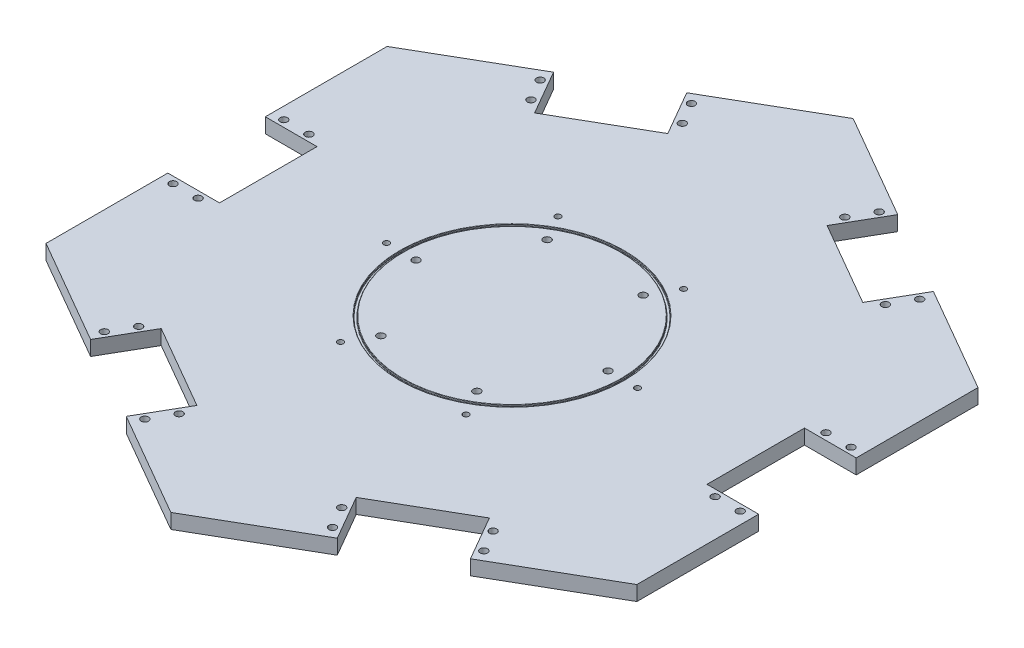
from build123d import *

# Parameters (mm, degrees)
BOSS_EXTRUDE1_DEPTH     = 10
CUT_EXTRUDE1_DEPTH      = 306.668665933
CUT_EXTRUDE1_DEPTH_BACK = 306.668665933
SKETCH2_R               = 2.5
SKETCH2_W               = 35
SKETCH2_H               = 66
FILLET1_R               = 0.254
CUT_EXTRUDE2_DEPTH      = 306.668665933
CUT_EXTRUDE2_DEPTH_BACK = 306.668665933
SKETCH5_R               = 2
SKETCH5_R_2             = 2.5


with BuildPart() as part:
    # Sketch1 → Boss-Extrude1 (new body)
    with BuildSketch(Plane(origin=(0, 0, 0), x_dir=(1, 0, 0), z_dir=(0, 1, 0))):
        Polygon((-200, 115.470053838), (0, 230.940107676), (200, 115.470053838), (200, -115.470053838), (0, -230.940107676), (-200, -115.470053838), align=None)
    extrude(amount=BOSS_EXTRUDE1_DEPTH)

    # Sketch2 → Cut-Extrude1 (cut, two sides: drawn at the far end of the back side and taken through both)
    with BuildSketch(Plane(origin=(0, 10, 0), x_dir=(1, 0, 0), z_dir=(0, 1, 0)).offset(-CUT_EXTRUDE1_DEPTH_BACK)):
        with Locations(Location((175, 37.5, 0), (0, 0, 270))):
            Circle(SKETCH2_R)
        with Locations((182.5, 0)):
            Rectangle(SKETCH2_W, SKETCH2_H)
        with Locations(Location((175, -37.5, 0), (0, 0, 270))):
            Circle(SKETCH2_R)
        Polygon((71.421161675, -189.705080757), (128.578838325, -156.705080757), (111.078838325, -126.394191624), (53.921161675, -159.394191624), align=None)
        Polygon((111.078838325, 126.394191624), (128.578838325, 156.705080757), (71.421161675, 189.705080757), (53.921161675, 159.394191624), align=None)
        Polygon((-128.578838325, -156.705080757), (-71.421161675, -189.705080757), (-53.921161675, -159.394191624), (-111.078838325, -126.394191624), align=None)
        Polygon((-53.921161675, 159.394191624), (-71.421161675, 189.705080757), (-128.578838325, 156.705080757), (-111.078838325, 126.394191624), align=None)
        with Locations((-182.5, 0)):
            Rectangle(SKETCH2_W, SKETCH2_H)
        with Locations(Location((192, 37.5, 0), (0, 0, 270))):
            Circle(SKETCH2_R)
        with Locations(Location((192, -37.5, 0), (0, 0, 270))):
            Circle(SKETCH2_R)
        with Locations(Location((119.975952642, -132.804445662, 0), (0, 0, 270))):
            Circle(SKETCH2_R)
        with Locations(Location((128.475952642, -147.526877527, 0), (0, 0, 270))):
            Circle(SKETCH2_R)
        with Locations(Location((55.024047358, -170.304445662, 0), (0, 0, 270))):
            Circle(SKETCH2_R)
        with Locations(Location((63.524047358, -185.026877527, 0), (0, 0, 270))):
            Circle(SKETCH2_R)
        with Locations(Location((-55.024047358, -170.304445662, 0), (0, 0, 270))):
            Circle(SKETCH2_R)
        with Locations(Location((-63.524047358, -185.026877527, 0), (0, 0, 270))):
            Circle(SKETCH2_R)
        with Locations(Location((-119.975952642, -132.804445662, 0), (0, 0, 270))):
            Circle(SKETCH2_R)
        with Locations(Location((-128.475952642, -147.526877527, 0), (0, 0, 270))):
            Circle(SKETCH2_R)
        with Locations(Location((-175, -37.5, 0), (0, 0, 270))):
            Circle(SKETCH2_R)
        with Locations(Location((-192, -37.5, 0), (0, 0, 270))):
            Circle(SKETCH2_R)
        with Locations(Location((-175, 37.5, 0), (0, 0, 270))):
            Circle(SKETCH2_R)
        with Locations(Location((-192, 37.5, 0), (0, 0, 270))):
            Circle(SKETCH2_R)
        with Locations(Location((-119.975952642, 132.804445662, 0), (0, 0, 270))):
            Circle(SKETCH2_R)
        with Locations(Location((-128.475952642, 147.526877527, 0), (0, 0, 270))):
            Circle(SKETCH2_R)
        with Locations(Location((-55.024047358, 170.304445662, 0), (0, 0, 270))):
            Circle(SKETCH2_R)
        with Locations(Location((-63.524047358, 185.026877527, 0), (0, 0, 270))):
            Circle(SKETCH2_R)
        with Locations(Location((55.024047358, 170.304445662, 0), (0, 0, 270))):
            Circle(SKETCH2_R)
        with Locations(Location((63.524047358, 185.026877527, 0), (0, 0, 270))):
            Circle(SKETCH2_R)
        with Locations(Location((119.975952642, 132.804445662, 0), (0, 0, 270))):
            Circle(SKETCH2_R)
        with Locations(Location((128.475952642, 147.526877527, 0), (0, 0, 270))):
            Circle(SKETCH2_R)
    extrude(amount=CUT_EXTRUDE1_DEPTH + CUT_EXTRUDE1_DEPTH_BACK, mode=Mode.SUBTRACT)

    # Cut-Sweep1: sweep along a path in Sketch4
    with BuildLine(Plane(origin=(0, 10, 0), x_dir=(1, 0, 0), z_dir=(0, 1, 0))) as cut_sweep1_path:
        CenterArc((0, 0), 75, 0, 360)
    # Sketch3 → Cut-Sweep1 (sweep, cut)
    with BuildSketch(Plane.XY):
        with BuildLine():
            Line((74.11, 10), (74.11, 8.984))
            ThreePointArc((74.11, 8.984), (74.184394878, 8.804394878), (74.364, 8.73))
            Line((74.364, 8.73), (75.636, 8.73))
            ThreePointArc((75.636, 8.73), (75.815605122, 8.804394878), (75.89, 8.984))
            Line((75.89, 8.984), (75.89, 10))
            Line((75.89, 10), (74.11, 10))
        make_face()
    sweep(path=cut_sweep1_path.line, mode=Mode.SUBTRACT)

    # Fillet1
    fillet1_edges = [part.edges().sort_by_distance(p)[0] for p in [
        (-75.89, 10, 0),
        (-74.11, 10, 0),
    ]]
    fillet(fillet1_edges, radius=FILLET1_R)

    # Sketch5 → Cut-Extrude2 (cut, two sides: drawn at the far end of the back side and taken through both)
    with BuildSketch(Plane(origin=(0, 10, 0), x_dir=(1, 0, 0), z_dir=(0, 1, 0)).offset(-CUT_EXTRUDE2_DEPTH_BACK)):
        with Locations(Location((85, 0, 0), (0, 0, 270))):
            Circle(SKETCH5_R)
        with Locations(Location((42.5, -73.612159322, 0), (0, 0, 270))):
            Circle(SKETCH5_R)
        with Locations(Location((-42.5, -73.612159322, 0), (0, 0, 270))):
            Circle(SKETCH5_R)
        with Locations(Location((-85, 0, 0), (0, 0, 270))):
            Circle(SKETCH5_R)
        with Locations(Location((-42.5, 73.612159322, 0), (0, 0, 270))):
            Circle(SKETCH5_R)
        with Locations(Location((42.5, 73.612159322, 0), (0, 0, 270))):
            Circle(SKETCH5_R)
        with Locations(Location((65, 0, 0), (0, 0, 270))):
            Circle(SKETCH5_R_2)
        with Locations(Location((32.5, -56.291651246, 0), (0, 0, 270))):
            Circle(SKETCH5_R_2)
        with Locations(Location((-32.5, -56.291651246, 0), (0, 0, 270))):
            Circle(SKETCH5_R_2)
        with Locations(Location((-65, 0, 0), (0, 0, 270))):
            Circle(SKETCH5_R_2)
        with Locations(Location((-32.5, 56.291651246, 0), (0, 0, 270))):
            Circle(SKETCH5_R_2)
        with Locations(Location((32.5, 56.291651246, 0), (0, 0, 270))):
            Circle(SKETCH5_R_2)
    extrude(amount=CUT_EXTRUDE2_DEPTH + CUT_EXTRUDE2_DEPTH_BACK, mode=Mode.SUBTRACT)


solid = part.part
